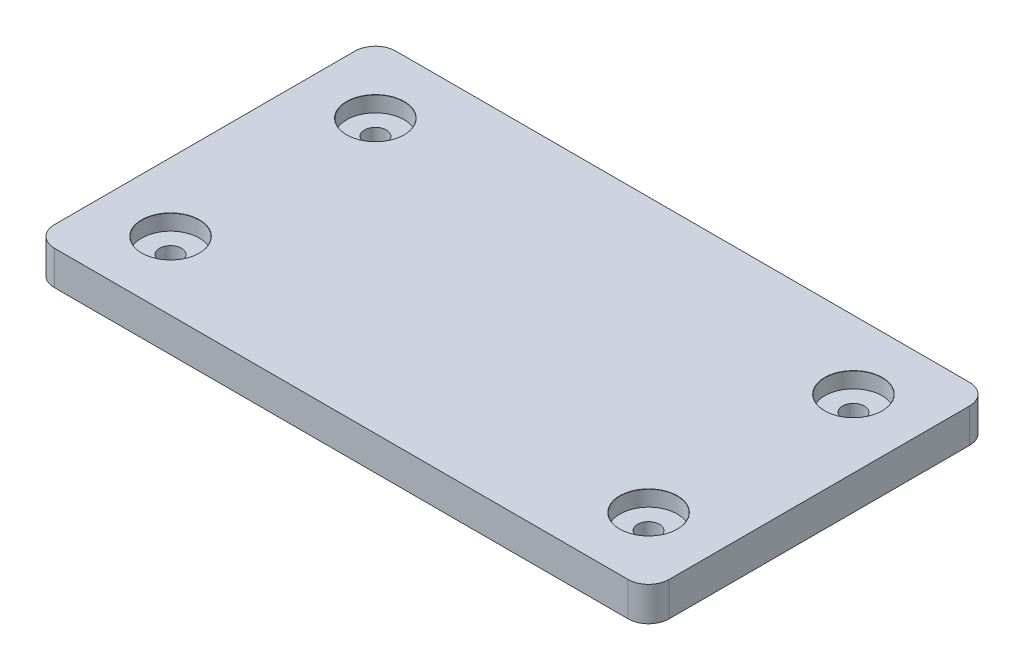
from build123d import *

# Parameters (mm, degrees)
SKETCH1_W                                     = 90
SKETCH1_H                                     = 50
BOSS_EXTRUDE2_DEPTH                           = 5
FILLET1_R                                     = 3
CBORE_FOR_M3_HEX_HEAD_MACHINE_SCREW1_AT_COUNT = 2
CBORE_FOR_M3_HEX_HEAD_MACHINE_SCREW1_AT_PITCH = 30
CBORE_FOR_M3_HEX_HEAD_MACHINE_SCREW1_2_COUNT  = 2
CBORE_FOR_M3_HEX_HEAD_MACHINE_SCREW1_2_PITCH  = 76.157731059
CBORE_FOR_M3_HEX_HEAD_MACHINE_SCREW1_3_COUNT  = 2
CBORE_FOR_M3_HEX_HEAD_MACHINE_SCREW1_3_PITCH  = 70


with BuildPart() as part:
    # Sketch1 → Boss-Extrude2 (new body)
    with BuildSketch(Plane(origin=(0, 0, 0), x_dir=(1, 0, 0), z_dir=(0, 1, 0))):
        Rectangle(SKETCH1_W, SKETCH1_H)
    extrude(amount=BOSS_EXTRUDE2_DEPTH)

    # Fillet1
    fillet1_edges = [part.edges().sort_by_distance(p)[0] for p in [
        (-45, 2.5, -25),
        (45, 2.5, -25),
        (45, 2.5, 25),
        (-45, 2.5, 25),
    ]]
    fillet(fillet1_edges, radius=FILLET1_R)

    # Sketch6 → CBORE for M3 Hex Head Machine Screw1 (revolve, cut)
    with BuildSketch(Plane(origin=(-35, 5, -15), x_dir=(0, 0, 1), z_dir=(1, 0, 0))):
        Polygon((0, 0), (0, 5.96137699), (1.6, 5), (1.6, 2.3), (4.2, 2.3), (4.2, 0.025), (4.225, 0), align=None)
    cbore_for_m3_hex_head_machine_screw1 = revolve(axis=Axis((-35, 11.35, -15), (0, -1, 0)), mode=Mode.SUBTRACT)

    # CBORE for M3 Hex Head Machine Screw1 at: CBORE for M3 Hex Head Machine Screw1 ×2
    with Locations(*[(0, 0, i * CBORE_FOR_M3_HEX_HEAD_MACHINE_SCREW1_AT_PITCH) for i in range(1, CBORE_FOR_M3_HEX_HEAD_MACHINE_SCREW1_AT_COUNT)]):
        add(cbore_for_m3_hex_head_machine_screw1, mode=Mode.SUBTRACT)

    # CBORE for M3 Hex Head Machine Screw1 2: CBORE for M3 Hex Head Machine Screw1 ×2
    with Locations(*[Vector(0.9191450300180579, 0, 0.3939192985791677) * (i * CBORE_FOR_M3_HEX_HEAD_MACHINE_SCREW1_2_PITCH) for i in range(1, CBORE_FOR_M3_HEX_HEAD_MACHINE_SCREW1_2_COUNT)]):
        add(cbore_for_m3_hex_head_machine_screw1, mode=Mode.SUBTRACT)

    # CBORE for M3 Hex Head Machine Screw1 3: CBORE for M3 Hex Head Machine Screw1 ×2
    with Locations(*[(i * CBORE_FOR_M3_HEX_HEAD_MACHINE_SCREW1_3_PITCH, 0, 0) for i in range(1, CBORE_FOR_M3_HEX_HEAD_MACHINE_SCREW1_3_COUNT)]):
        add(cbore_for_m3_hex_head_machine_screw1, mode=Mode.SUBTRACT)


solid = part.part
